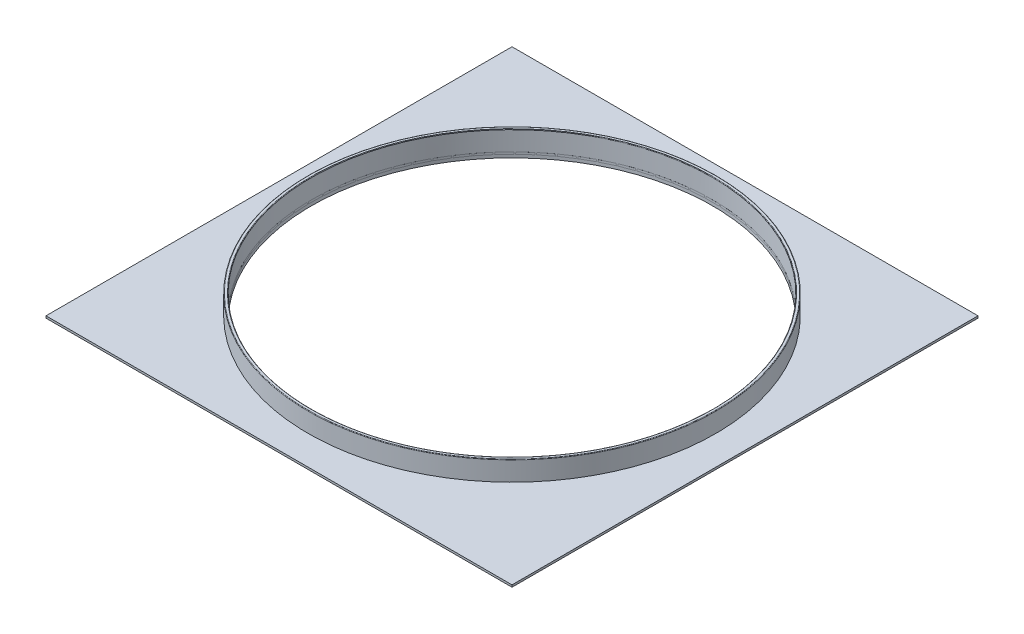
from build123d import *

# Parameters (mm, degrees)
FILLET3_R           = 0.79375
FILLET4_R           = 0.79375
SKETCH3_R           = 5.55625
CUT_EXTRUDE1_DEPTH  = 496.037891525
CIRPATTERN1_COUNT   = 12
SKETCH4_W           = 711.2
SKETCH4_H           = 711.2
SKETCH4_R           = 306.3875
BOSS_EXTRUDE1_DEPTH = 3.175


with BuildPart() as part:
    # Sketch1 → Revolve1 (revolve)
    with BuildSketch(Plane(origin=(0, 0, 0), x_dir=(0, 0, -1), z_dir=(1, 0, 0)), mode=Mode.PRIVATE) as revolve1_sk:
        Polygon((306.3875, 0), (349.25, 0), (349.25, 4.7625), (311.15, 4.7625), (311.15, 38.1), (306.3875, 38.1), align=None)
    revolve(revolve1_sk.sketch.rotate(Axis((0, 38.1, 0), (0, -1, 0)), 180), axis=Axis((0, 38.1, 0), (0, -1, 0)))

    # Fillet3
    fillet3_edges = [part.edges().sort_by_distance(p)[0] for p in [
        (0, 0, -349.25),
        (0, 4.7625, -349.25),
    ]]
    fillet(fillet3_edges, radius=FILLET3_R)

    # Fillet4
    fillet4_edges = [part.edges().sort_by_distance(p)[0] for p in [
        (0, 38.1, -306.3875),
        (0, 38.1, -311.15),
        (0, 4.7625, -311.15),
    ]]
    fillet(fillet4_edges, radius=FILLET4_R)

    # Sketch3 → Cut-Extrude1 (cut, through all)
    with BuildSketch(Plane(origin=(0, 4.7625, 0), x_dir=(-1, 0, 0), z_dir=(0, 1, 0))):
        with Locations(Location((0, -328.6125, 0), (0, 0, 90))):
            Circle(SKETCH3_R)
    cut_extrude1 = extrude(amount=-CUT_EXTRUDE1_DEPTH, mode=Mode.SUBTRACT)

    # CirPattern1: Cut-Extrude1 ×12 about axis
    cirpattern1_axis = Axis((0, 0, 0), (0, 1, 0))
    for i in range(1, CIRPATTERN1_COUNT):
        add(cut_extrude1.rotate(cirpattern1_axis, i * 360 / CIRPATTERN1_COUNT), mode=Mode.SUBTRACT)


with BuildPart() as body_2:
    # Sketch4 → Boss-Extrude1 (new body)
    with BuildSketch(Plane(origin=(0, 4.7625, 0), x_dir=(1, 0, 0), z_dir=(0, 1, 0))):
        Rectangle(SKETCH4_W, SKETCH4_H)
        with Locations(Location((0, 0, 0), (0, 0, 270))):
            Circle(SKETCH4_R, mode=Mode.SUBTRACT)
    extrude(amount=BOSS_EXTRUDE1_DEPTH)


solid = Compound([part.part, body_2.part])
